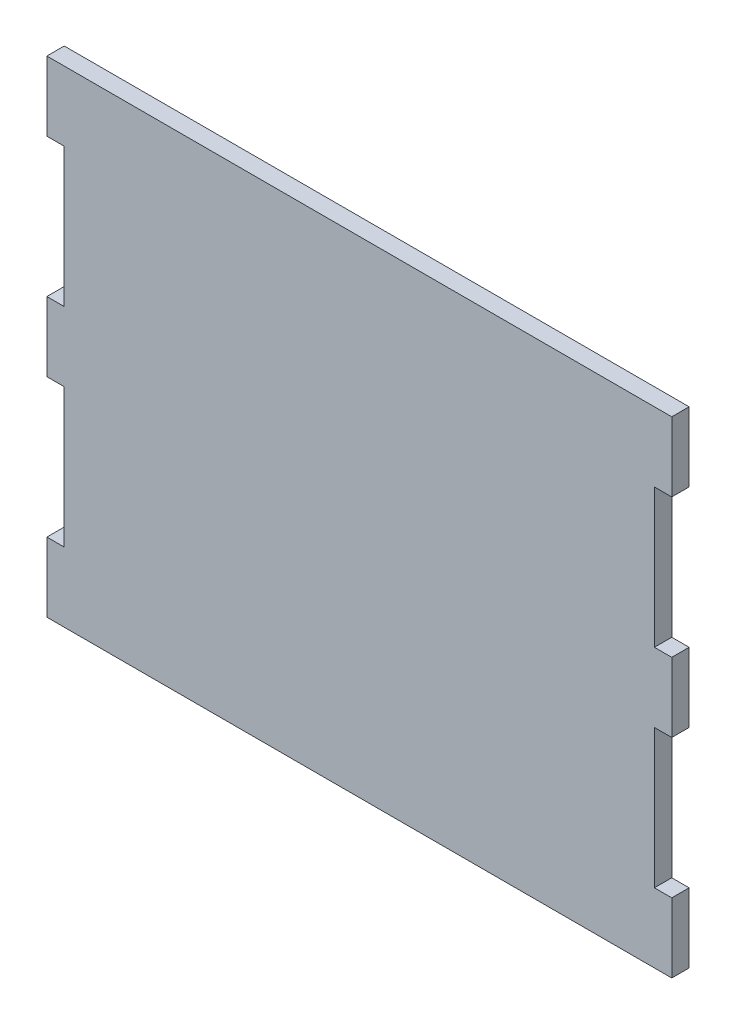
from build123d import *

# Parameters (mm, degrees)
CROQUIS1_W                = 180
CROQUIS1_H                = 140
SALIENTE_EXTRUIR1_DEPTH   = 5
CROQUIS4_W                = 5
CROQUIS4_H                = 40
CORTAR_EXTRUIR3_DEPTH     = 115.127122105
SIMETR_A5_COPY_1_SKETCH_W = 5
SIMETR_A5_COPY_1_SKETCH_H = 40
SIMETR_A5_COPY_1_DEPTH    = 115.127122105


with BuildPart() as part:
    # Croquis1 → Saliente-Extruir1 (new body)
    with BuildSketch(Plane.XY):
        Rectangle(CROQUIS1_W, CROQUIS1_H)
    extrude(amount=SALIENTE_EXTRUIR1_DEPTH)

    # Croquis4 → Cortar-Extruir3 (cut, through all)
    with BuildSketch(Plane.XY.offset(5)):
        with Locations((-87.5, 30)):
            Rectangle(CROQUIS4_W, CROQUIS4_H)
    cortar_extruir3 = extrude(amount=-CORTAR_EXTRUIR3_DEPTH, mode=Mode.SUBTRACT)

    # Simetría4: Cortar-Extruir3 across plane
    add(cortar_extruir3.mirror(Plane.ZX), mode=Mode.SUBTRACT)

    # Simetría5: Cortar-Extruir3 across plane
    add(cortar_extruir3.mirror(Plane(origin=(0, 0, 0), x_dir=(0, 0, 1), z_dir=(1, 0, 0))), mode=Mode.SUBTRACT)

    # Simetría5 copy 1 sketch → Simetría5 copy 1 (cut, through all)
    with BuildSketch(Plane(origin=(0, 0, 5), x_dir=(-1, 0, 0), z_dir=(0, 0, 1))):
        with Locations((-87.5, 30)):
            Rectangle(SIMETR_A5_COPY_1_SKETCH_W, SIMETR_A5_COPY_1_SKETCH_H)
    extrude(amount=-SIMETR_A5_COPY_1_DEPTH, mode=Mode.SUBTRACT)


solid = part.part
